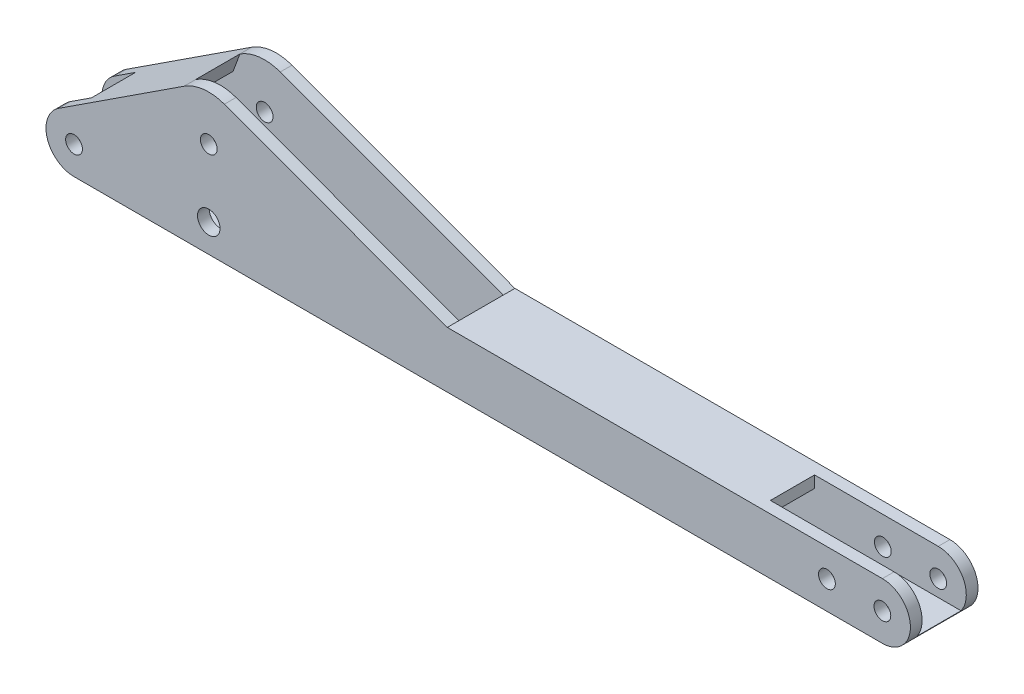
from build123d import *

# Parameters (mm, degrees)
SKETCH1_R           = 38
SKETCH1_R_2         = 51
BOSS_EXTRUDE1_DEPTH = 306
SKETCH8_W           = 1075.201841516
SKETCH8_H           = 200
SKETCH8_W_2         = 164.33390396
CUT_EXTRUDE5_DEPTH  = 3620.888611426
SKETCH2_W           = 560
SKETCH2_H           = 200
SKETCH2_W_2         = 127
CUT_EXTRUDE10_DEPTH = 201
SKETCH15_W          = 200
SKETCH15_H          = 148
CUT_EXTRUDE11_DEPTH = 3304.473020928
CUT_EXTRUDE12_START = -53
SKETCH16_R          = 38
CUT_EXTRUDE12_DEPTH = 200
SKETCH18_W          = 200
SKETCH18_H          = 203.424864611
CUT_EXTRUDE13_DEPTH = 3691.825090025


with BuildPart() as part:
    # Sketch1 → Boss-Extrude1 (new body)
    with BuildSketch(Plane.XY):
        with BuildLine():
            Line((20.424857609, 0), (3680.424857609, 0))
            ThreePointArc((3680.424857609, 0), (3807.424857609, 127), (3680.424857609, 254))
            Line((3680.424857609, 254), (1710.424857609, 254))
            Line((1710.424857609, 254), (701.055226762, 624.448307224))
            ThreePointArc((701.055226762, 624.448307224), (607.25608652, 635.686543606), (518.377147917, 603.669189876))
            Line((518.377147917, 603.669189876), (-48.990064981, 233.351156655))
            ThreePointArc((-48.990064981, 233.351156655), (-101.303522186, 90.789482848), (20.424857609, 0))
        make_face()
        with Locations((20.424857609, 127)):
            Circle(SKETCH1_R, mode=Mode.SUBTRACT)
        with Locations((630.424857609, 127)):
            Circle(SKETCH1_R_2, mode=Mode.SUBTRACT)
        with Locations((630.424857609, 432)):
            Circle(SKETCH1_R, mode=Mode.SUBTRACT)
        with Locations((3680.424857609, 127)):
            Circle(SKETCH1_R, mode=Mode.SUBTRACT)
        with Locations((3429.424857609, 127)):
            Circle(SKETCH1_R, mode=Mode.SUBTRACT)
    extrude(amount=-BOSS_EXTRUDE1_DEPTH)

    # Sketch8 → Cut-Extrude5 (cut, through all)
    with BuildSketch(Plane(origin=(285.193429172, 777.073563867, 0), x_dir=(0.9387722303591257, -0.3445383861147445, 0), z_dir=(0.3445383861147445, 0.9387722303591257, 0))):
        with Locations((980.585687608, 153)):
            Rectangle(SKETCH8_W, SKETCH8_H)
        with Locations((360.81781487, 153)):
            Rectangle(SKETCH8_W_2, SKETCH8_H)
    extrude(amount=-CUT_EXTRUDE5_DEPTH, mode=Mode.SUBTRACT)

    # Sketch2 → Cut-Extrude10 (cut)
    with BuildSketch(Plane(origin=(0, 254, 0), x_dir=(1, 0, 0), z_dir=(0, 1, 0))):
        with Locations((3400.424857609, 153)):
            Rectangle(SKETCH2_W, SKETCH2_H)
        with Locations((3743.924857609, 153)):
            Rectangle(SKETCH2_W_2, SKETCH2_H)
    extrude(amount=-CUT_EXTRUDE10_DEPTH, mode=Mode.SUBTRACT)

    # Sketch15 → Cut-Extrude11 (cut, through all)
    with BuildSketch(Plane(origin=(3120.424857609, 0, 0), x_dir=(0, 0, -1), z_dir=(1, 0, 0))):
        with Locations((153, 127)):
            Rectangle(SKETCH15_W, SKETCH15_H)
    extrude(amount=-CUT_EXTRUDE11_DEPTH, mode=Mode.SUBTRACT)

    # Sketch16 → Cut-Extrude12 (cut)
    with BuildSketch(Plane.XY.offset(CUT_EXTRUDE12_START)):
        with BuildLine():
            Line((45.924857609, 295.301700602), (-48.990064981, 233.351156655))
            ThreePointArc((-48.990064981, 233.351156655), (-101.303522186, 90.789482848), (20.424857609, 0))
            Line((20.424857609, 0), (238.666952125, 0))
            Line((238.666952125, 0), (45.924857609, 295.301700602))
        make_face()
        with Locations((20.424857609, 127)):
            Circle(SKETCH16_R, mode=Mode.SUBTRACT)
    extrude(amount=-CUT_EXTRUDE12_DEPTH, mode=Mode.SUBTRACT)

    # Sketch18 → Cut-Extrude13 (cut, through all)
    with BuildSketch(Plane(origin=(167.36678752, 109.239550986, 0), x_dir=(0, 0, 1), z_dir=(-0.8374106823227343, -0.5465741936203838, 0))):
        with Locations((-153, 67.475024273)):
            Rectangle(SKETCH18_W, SKETCH18_H)
    extrude(amount=-CUT_EXTRUDE13_DEPTH, mode=Mode.SUBTRACT)

    # loft from a face of the part (loft7)
    loft([part.faces().sort_by_distance((1626.930182004, 26.5, -153))[0], part.faces().sort_by_distance((306.550535705, 26.5, -153))[0]])


solid = part.part
